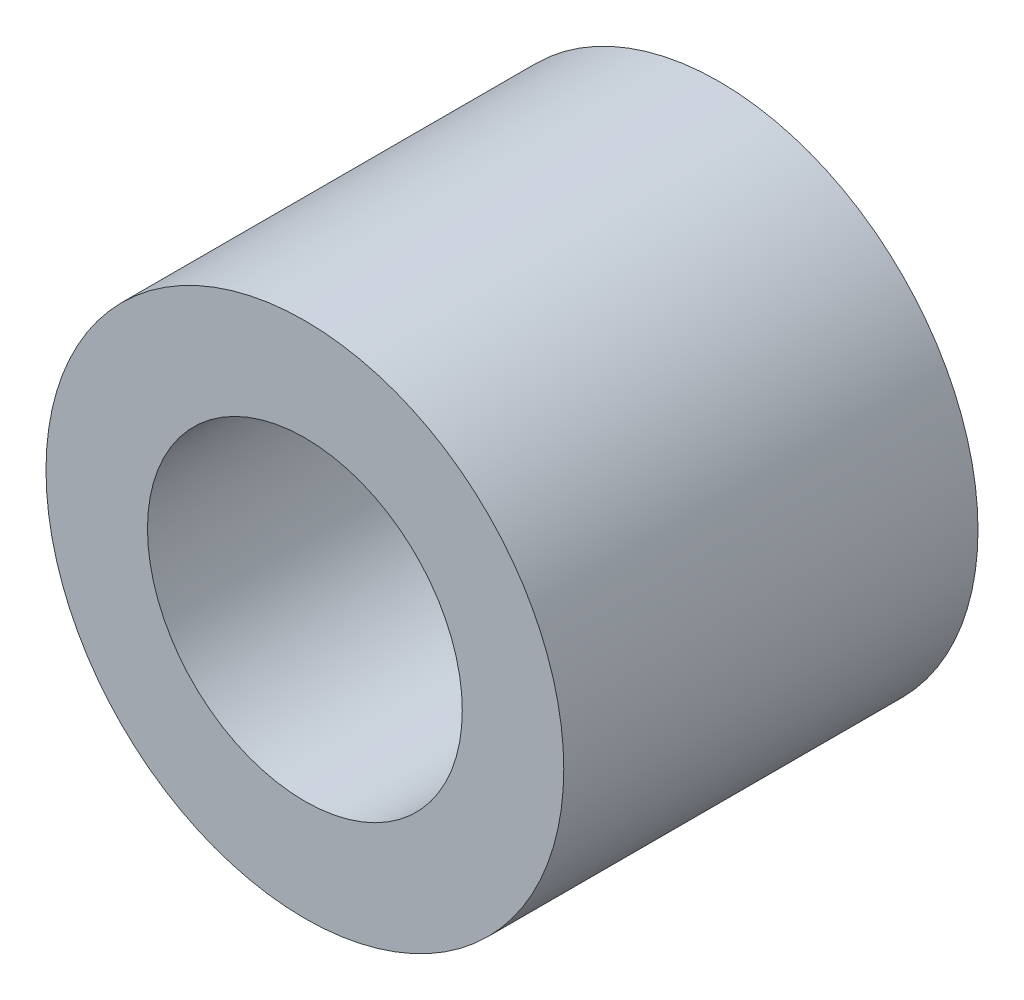
from build123d import *

# Parameters (mm, degrees)
BOSS_EXTRUDE1_DEPTH      = 152.4
BOSS_EXTRUDE1_DEPTH_BACK = 152.4
SKETCH3_R                = 7.9375
SKETCH3_R_2              = 4.826
SKETCH4_R                = 7.9375
CUT_EXTRUDE1_DEPTH       = 292.1


with BuildPart() as part:
    # Sketch3 → Boss-Extrude1 (new, two sides: drawn at the far end of the back side and taken through both)
    with BuildSketch(Plane.XY.offset(-BOSS_EXTRUDE1_DEPTH_BACK)):
        Circle(SKETCH3_R)
        Circle(SKETCH3_R_2, mode=Mode.SUBTRACT)
    extrude(amount=BOSS_EXTRUDE1_DEPTH + BOSS_EXTRUDE1_DEPTH_BACK)

    # Sketch4 → Cut-Extrude1 (cut)
    with BuildSketch(Plane.XY.offset(152.4)):
        Circle(SKETCH4_R)
    extrude(amount=-CUT_EXTRUDE1_DEPTH, mode=Mode.SUBTRACT)


solid = part.part
